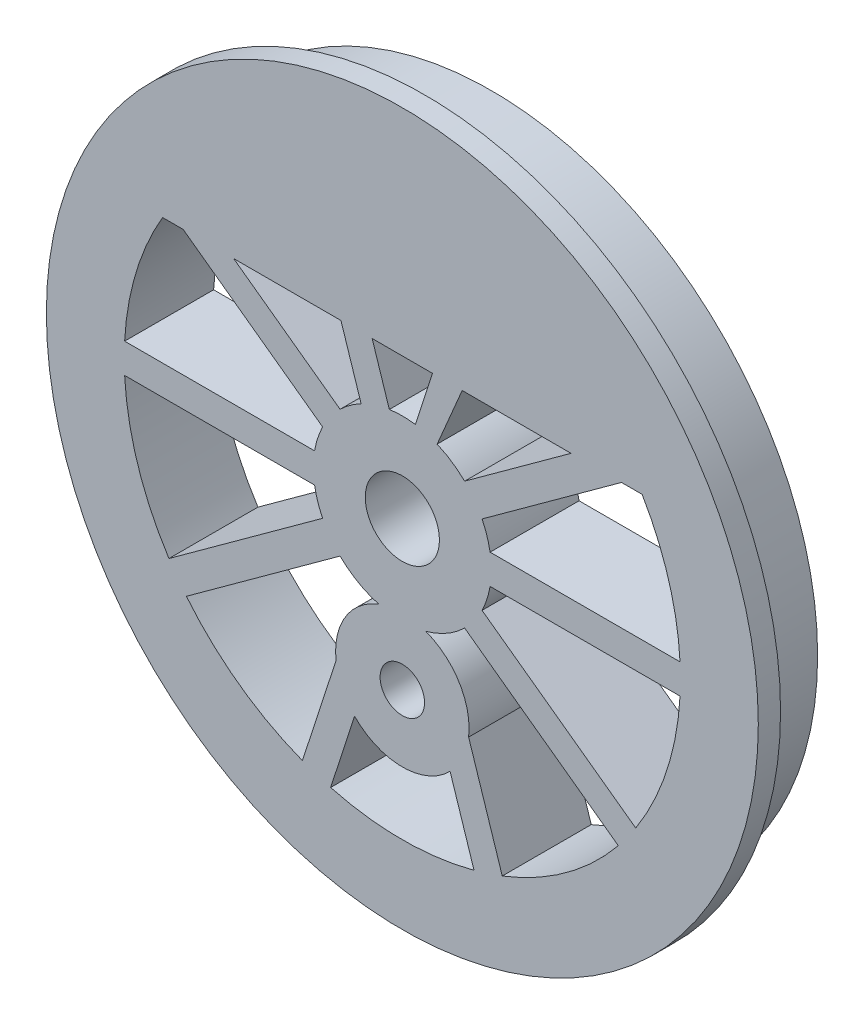
from build123d import *

# Parameters (mm, degrees)
ESQUISSE1_R        = 6
ESQUISSE1_R_2      = 2.5
ESQUISSE1_R_3      = 1.5
BOSS_EXTRU_1_DEPTH = 6
BOSS_EXTRU_2_START = -1.5
ESQUISSE3_R        = 24
ESQUISSE3_R_2      = 22
BOSS_EXTRU_2_DEPTH = 1.5


with BuildPart() as part:
    # Esquisse1 → Boss.-Extru.1 (new body)
    # profile 1 of 61: a face of its own
    with BuildSketch(Plane.XY):
        Circle(ESQUISSE1_R)
        Circle(ESQUISSE1_R_2, mode=Mode.SUBTRACT)
    # profile 2 of 61: a face of its own
    with BuildSketch(Plane.XY):
        with BuildLine():
            Line((-14.776929861, 9.5), (-5.373994337, 2.668367454))
            ThreePointArc((-5.373994337, 2.668367454), (-4.854101966, 3.526711514), (-4.198423832, 4.286401442))
            Line((-4.198423832, 4.286401442), (-11.374326628, 9.5))
            Line((-11.374326628, 9.5), (-14.776929861, 9.5))
        make_face()
    # profile 3 of 61: a face of its own
    with BuildSketch(Plane.XY):
        with BuildLine():
            Line((-14.559694243, 11.814305039), (-11.374326628, 9.5))
            Line((-11.374326628, 9.5), (-4.138199338, 9.5))
            Line((-4.138199338, 9.5), (-4.469792035, 10.520537382))
            Line((-4.469792035, 10.520537382), (-6.736878839, 17.497913119))
            ThreePointArc((-6.736878839, 17.497913119), (-11.02097348, 15.169068645), (-14.559694243, 11.814305039))
        make_face()
    # profile 4 of 61: a face of its own
    with BuildSketch(Plane.XY):
        with BuildLine():
            Line((-4.138199338, 9.5), (-2.03527489, 9.5))
            Line((-2.03527489, 9.5), (-3.219339867, 13.144177288))
            Line((-3.219339867, 13.144177288), (-4.834765807, 18.115947107))
            ThreePointArc((-4.834765807, 18.115947107), (-5.794068645, 17.832309681), (-6.736878839, 17.497913119))
            Line((-6.736878839, 17.497913119), (-4.469792035, 10.520537382))
            Line((-4.469792035, 10.520537382), (-4.138199338, 9.5))
        make_face()
    # profile 5 of 61: a face of its own
    with BuildSketch(Plane.XY):
        with BuildLine():
            Line((-2.03527489, 9.5), (2.03527489, 9.5))
            Line((2.03527489, 9.5), (3.219339867, 13.144177288))
            Line((3.219339867, 13.144177288), (4.834765807, 18.115947107))
            ThreePointArc((4.834765807, 18.115947107), (0, 18.75), (-4.834765807, 18.115947107))
            Line((-4.834765807, 18.115947107), (-3.219339867, 13.144177288))
            Line((-3.219339867, 13.144177288), (-2.03527489, 9.5))
        make_face()
    # profile 6 of 61: a face of its own
    with BuildSketch(Plane.XY):
        with BuildLine():
            Line((2.03527489, 9.5), (4.03620298, 9.5))
            Line((4.03620298, 9.5), (4.469792035, 10.520537382))
            Line((4.469792035, 10.520537382), (6.736878839, 17.497913119))
            ThreePointArc((6.736878839, 17.497913119), (5.794068645, 17.832309681), (4.834765807, 18.115947107))
            Line((4.834765807, 18.115947107), (3.219339867, 13.144177288))
            Line((3.219339867, 13.144177288), (2.03527489, 9.5))
        make_face()
    # profile 7 of 61: a face of its own
    with BuildSketch(Plane.XY):
        with BuildLine():
            Line((4.03620298, 9.5), (11.374326628, 9.5))
            Line((11.374326628, 9.5), (14.559694243, 11.814305039))
            ThreePointArc((14.559694243, 11.814305039), (11.02097348, 15.169068645), (6.736878839, 17.497913119))
            Line((6.736878839, 17.497913119), (4.469792035, 10.520537382))
            Line((4.469792035, 10.520537382), (4.03620298, 9.5))
        make_face()
    # profile 8 of 61: a face of its own
    with BuildSketch(Plane.XY):
        with BuildLine():
            Line((11.374326628, 9.5), (14.776929861, 9.5))
            Line((14.776929861, 9.5), (15.735264747, 10.196271051))
            ThreePointArc((15.735264747, 10.196271051), (15.169068645, 11.02097348), (14.559694243, 11.814305039))
            Line((14.559694243, 11.814305039), (11.374326628, 9.5))
        make_face()
    # profile 9 of 61: a face of its own
    with BuildSketch(Plane.XY):
        with BuildLine():
            ThreePointArc((4.198423832, 4.286401442), (4.854101966, 3.526711514), (5.373994337, 2.668367454))
            Line((5.373994337, 2.668367454), (14.776929861, 9.5))
            Line((14.776929861, 9.5), (11.374326628, 9.5))
            Line((11.374326628, 9.5), (4.198423832, 4.286401442))
        make_face()
    # profile 10 of 61: a face of its own
    with BuildSketch(Plane.XY):
        with BuildLine():
            ThreePointArc((0.877112677, 5.935543223), (1.624852602, 5.775798994), (2.346205228, 5.522256878))
            Line((2.346205228, 5.522256878), (4.03620298, 9.5))
            Line((4.03620298, 9.5), (2.03527489, 9.5))
            Line((2.03527489, 9.5), (0.877112677, 5.935543223))
        make_face()
    # profile 11 of 61: a face of its own
    with BuildSketch(Plane.XY):
        with BuildLine():
            ThreePointArc((-2.779225709, 5.317509234), (-1.854101966, 5.706339098), (-0.877112677, 5.935543223))
            Line((-0.877112677, 5.935543223), (-2.03527489, 9.5))
            Line((-2.03527489, 9.5), (-4.138199338, 9.5))
            Line((-4.138199338, 9.5), (-2.779225709, 5.317509234))
        make_face()
    # profile 12 of 61: a face of its own
    with BuildSketch(Plane.XY):
        with BuildLine():
            Line((-14.559694243, -11.814305039), (-4.198423832, -4.286401442))
            ThreePointArc((-4.198423832, -4.286401442), (-4.854101966, -3.526711514), (-5.373994337, -2.668367454))
            Line((-5.373994337, -2.668367454), (-15.735264747, -10.196271051))
            ThreePointArc((-15.735264747, -10.196271051), (-15.169068645, -11.02097348), (-14.559694243, -11.814305039))
        make_face()
    # profile 13 of 61: a face of its own
    with BuildSketch(Plane.XY):
        with BuildLine():
            Line((-18.723314343, -1), (-5.916079783, -1))
            ThreePointArc((-5.916079783, -1), (-6, 0), (-5.916079783, 1))
            Line((-5.916079783, 1), (-18.723314343, 1))
            ThreePointArc((-18.723314343, 1), (-18.75, 0), (-18.723314343, -1))
        make_face()
    # profile 14 of 61: a face of its own
    with BuildSketch(Plane.XY):
        with BuildLine():
            ThreePointArc((6, 0), (5.978983137, -0.501757562), (5.916079783, -1))
            Line((5.916079783, -1), (18.723314343, -1))
            ThreePointArc((18.723314343, -1), (18.743327399, -0.500177999), (18.75, 0))
            ThreePointArc((18.75, 0), (18.743327399, 0.500177999), (18.723314343, 1))
            Line((18.723314343, 1), (5.916079783, 1))
            ThreePointArc((5.916079783, 1), (5.978983137, 0.501757562), (6, 0))
        make_face()
    # profile 15 of 61: a face of its own
    with BuildSketch(Plane.XY):
        with BuildLine():
            ThreePointArc((18.723314343, -1), (17.832309681, -5.794068645), (15.735264747, -10.196271051))
            Line((15.735264747, -10.196271051), (16.342858961, -10.637714087))
            ThreePointArc((16.342858961, -10.637714087), (18.545602068, -6.02583139), (19.474342094, -1))
            Line((19.474342094, -1), (18.723314343, -1))
        make_face()
    # profile 16 of 61: a face of its own
    with BuildSketch(Plane.XY):
        with BuildLine():
            ThreePointArc((18.75, 0), (18.743327399, -0.500177999), (18.723314343, -1))
            Line((18.723314343, -1), (19.474342094, -1))
            ThreePointArc((19.474342094, -1), (19.493584468, -0.500164555), (19.5, 0))
            ThreePointArc((19.5, 0), (19.493584468, 0.500164555), (19.474342094, 1))
            Line((19.474342094, 1), (18.723314343, 1))
            ThreePointArc((18.723314343, 1), (18.743327399, 0.500177999), (18.75, 0))
        make_face()
    # profile 17 of 61: a face of its own
    with BuildSketch(Plane.XY):
        with BuildLine():
            ThreePointArc((16.16516316, 9.5), (17.954497087, 5.403566819), (18.723314343, 1))
            Line((18.723314343, 1), (19.474342094, 1))
            ThreePointArc((19.474342094, 1), (18.545602068, 6.02583139), (16.342858961, 10.637714087))
            Line((16.342858961, 10.637714087), (15.735264747, 10.196271051))
            ThreePointArc((15.735264747, 10.196271051), (15.954012771, 9.850481028), (16.16516316, 9.5))
        make_face()
    # profile 18 of 61: a face of its own
    with BuildSketch(Plane.XY):
        with BuildLine():
            Line((15.735264747, 10.196271051), (16.342858961, 10.637714087))
            ThreePointArc((16.342858961, 10.637714087), (15.77583139, 11.46181242), (15.167288456, 12.255748075))
            Line((15.167288456, 12.255748075), (14.559694243, 11.814305039))
            ThreePointArc((14.559694243, 11.814305039), (15.169068645, 11.02097348), (15.735264747, 10.196271051))
        make_face()
    # profile 19 of 61: a face of its own
    with BuildSketch(Plane.XY):
        with BuildLine():
            Line((14.559694243, 11.814305039), (15.167288456, 12.255748075))
            ThreePointArc((15.167288456, 12.255748075), (11.46181242, 15.77583139), (6.968959178, 18.212182955))
            Line((6.968959178, 18.212182955), (6.736878839, 17.497913119))
            ThreePointArc((6.736878839, 17.497913119), (11.02097348, 15.169068645), (14.559694243, 11.814305039))
        make_face()
    # profile 20 of 61: a face of its own
    with BuildSketch(Plane.XY):
        with BuildLine():
            Line((6.736878839, 17.497913119), (6.968959178, 18.212182955))
            ThreePointArc((6.968959178, 18.212182955), (6.02583139, 18.545602068), (5.066846145, 18.830216944))
            Line((5.066846145, 18.830216944), (4.834765807, 18.115947107))
            ThreePointArc((4.834765807, 18.115947107), (5.794068645, 17.832309681), (6.736878839, 17.497913119))
        make_face()
    # profile 21 of 61: a face of its own
    with BuildSketch(Plane.XY):
        with BuildLine():
            Line((4.834765807, 18.115947107), (5.066846145, 18.830216944))
            ThreePointArc((5.066846145, 18.830216944), (0, 19.5), (-5.066846145, 18.830216944))
            Line((-5.066846145, 18.830216944), (-4.834765807, 18.115947107))
            ThreePointArc((-4.834765807, 18.115947107), (0, 18.75), (4.834765807, 18.115947107))
        make_face()
    # profile 22 of 61: a face of its own
    with BuildSketch(Plane.XY):
        with BuildLine():
            Line((-4.834765807, 18.115947107), (-5.066846145, 18.830216944))
            ThreePointArc((-5.066846145, 18.830216944), (-6.02583139, 18.545602068), (-6.968959178, 18.212182955))
            Line((-6.968959178, 18.212182955), (-6.736878839, 17.497913119))
            ThreePointArc((-6.736878839, 17.497913119), (-5.794068645, 17.832309681), (-4.834765807, 18.115947107))
        make_face()
    # profile 23 of 61: a face of its own
    with BuildSketch(Plane.XY):
        with BuildLine():
            Line((-6.736878839, 17.497913119), (-6.968959178, 18.212182955))
            ThreePointArc((-6.968959178, 18.212182955), (-11.46181242, 15.77583139), (-15.167288456, 12.255748075))
            Line((-15.167288456, 12.255748075), (-14.559694243, 11.814305039))
            ThreePointArc((-14.559694243, 11.814305039), (-11.02097348, 15.169068645), (-6.736878839, 17.497913119))
        make_face()
    # profile 24 of 61: a face of its own
    with BuildSketch(Plane.XY):
        with BuildLine():
            ThreePointArc((-15.167288456, 12.255748075), (-15.77583139, 11.46181242), (-16.342858961, 10.637714087))
            Line((-16.342858961, 10.637714087), (-15.735264747, 10.196271051))
            ThreePointArc((-15.735264747, 10.196271051), (-15.169068645, 11.02097348), (-14.559694243, 11.814305039))
            Line((-14.559694243, 11.814305039), (-15.167288456, 12.255748075))
        make_face()
    # profile 25 of 61: a face of its own
    with BuildSketch(Plane.XY):
        with BuildLine():
            Line((-19.474342094, 1), (-18.723314343, 1))
            ThreePointArc((-18.723314343, 1), (-17.954497087, 5.403566819), (-16.16516316, 9.5))
            ThreePointArc((-16.16516316, 9.5), (-15.954012771, 9.850481028), (-15.735264747, 10.196271051))
            Line((-15.735264747, 10.196271051), (-16.342858961, 10.637714087))
            ThreePointArc((-16.342858961, 10.637714087), (-18.545602068, 6.02583139), (-19.474342094, 1))
        make_face()
    # profile 26 of 61: a face of its own
    with BuildSketch(Plane.XY):
        with BuildLine():
            Line((-19.474342094, -1), (-18.723314343, -1))
            ThreePointArc((-18.723314343, -1), (-18.75, 0), (-18.723314343, 1))
            Line((-18.723314343, 1), (-19.474342094, 1))
            ThreePointArc((-19.474342094, 1), (-19.5, 0), (-19.474342094, -1))
        make_face()
    # profile 27 of 61: a face of its own
    with BuildSketch(Plane.XY):
        with BuildLine():
            Line((-16.342858961, -10.637714087), (-15.735264747, -10.196271051))
            ThreePointArc((-15.735264747, -10.196271051), (-17.832309681, -5.794068645), (-18.723314343, -1))
            Line((-18.723314343, -1), (-19.474342094, -1))
            ThreePointArc((-19.474342094, -1), (-18.545602068, -6.02583139), (-16.342858961, -10.637714087))
        make_face()
    # profile 28 of 61: a face of its own
    with BuildSketch(Plane.XY):
        with BuildLine():
            Line((-15.167288456, -12.255748075), (-14.559694243, -11.814305039))
            ThreePointArc((-14.559694243, -11.814305039), (-15.169068645, -11.02097348), (-15.735264747, -10.196271051))
            Line((-15.735264747, -10.196271051), (-16.342858961, -10.637714087))
            ThreePointArc((-16.342858961, -10.637714087), (-15.77583139, -11.46181242), (-15.167288456, -12.255748075))
        make_face()
    # profile 29 of 61: a face of its own
    with BuildSketch(Plane.XY):
        with BuildLine():
            Line((5.840290615, -21.210634256), (5.066846145, -18.830216944))
            ThreePointArc((5.066846145, -18.830216944), (0, -19.5), (-5.066846145, -18.830216944))
            Line((-5.066846145, -18.830216944), (-5.840290615, -21.210634256))
            ThreePointArc((-5.840290615, -21.210634256), (0, -22), (5.840290615, -21.210634256))
        make_face()
    # profile 30 of 61: a face of its own
    with BuildSketch(Plane.XY):
        with BuildLine():
            Line((-17.192192367, -13.726926882), (-15.167288456, -12.255748075))
            ThreePointArc((-15.167288456, -12.255748075), (-15.77583139, -11.46181242), (-16.342858961, -10.637714087))
            Line((-16.342858961, -10.637714087), (-18.367762872, -12.108892893))
            ThreePointArc((-18.367762872, -12.108892893), (-17.798373876, -12.93127555), (-17.192192367, -13.726926882))
        make_face()
    # profile 31 of 61: a face of its own
    with BuildSketch(Plane.XY):
        with BuildLine():
            Line((-5.840290615, -21.210634256), (-5.066846145, -18.830216944))
            ThreePointArc((-5.066846145, -18.830216944), (-6.02583139, -18.545602068), (-6.968959178, -18.212182955))
            Line((-6.968959178, -18.212182955), (-7.742403648, -20.592600267))
            ThreePointArc((-7.742403648, -20.592600267), (-6.798373876, -20.923243358), (-5.840290615, -21.210634256))
        make_face()
    # profile 32 of 61: a face of its own
    with BuildSketch(Plane.XY):
        with BuildLine():
            ThreePointArc((-3.219339867, -13.144177288), (-4.06221109, -11.936089115), (-4.469792035, -10.520537382))
            Line((-4.469792035, -10.520537382), (-6.736878839, -17.497913119))
            ThreePointArc((-6.736878839, -17.497913119), (-5.794068645, -17.832309681), (-4.834765807, -18.115947107))
            Line((-4.834765807, -18.115947107), (-3.219339867, -13.144177288))
        make_face()
    # profile 33 of 61: a face of its own
    with BuildSketch(Plane.XY):
        with BuildLine():
            ThreePointArc((4.834765807, -18.115947107), (5.794068645, -17.832309681), (6.736878839, -17.497913119))
            Line((6.736878839, -17.497913119), (4.469792035, -10.520537382))
            ThreePointArc((4.469792035, -10.520537382), (4.06221109, -11.936089115), (3.219339867, -13.144177288))
            Line((3.219339867, -13.144177288), (4.834765807, -18.115947107))
        make_face()
    # profile 34 of 61: a face of its own
    with BuildSketch(Plane.XY):
        with BuildLine():
            Line((7.742403648, -20.592600267), (6.968959178, -18.212182955))
            ThreePointArc((6.968959178, -18.212182955), (6.02583139, -18.545602068), (5.066846145, -18.830216944))
            Line((5.066846145, -18.830216944), (5.840290615, -21.210634256))
            ThreePointArc((5.840290615, -21.210634256), (6.798373876, -20.923243358), (7.742403648, -20.592600267))
        make_face()
    # profile 35 of 61: a face of its own
    with BuildSketch(Plane.XY):
        with BuildLine():
            Line((17.192192367, -13.726926882), (15.167288456, -12.255748075))
            ThreePointArc((15.167288456, -12.255748075), (11.46181242, -15.77583139), (6.968959178, -18.212182955))
            Line((6.968959178, -18.212182955), (7.742403648, -20.592600267))
            ThreePointArc((7.742403648, -20.592600267), (12.93127555, -17.798373876), (17.192192367, -13.726926882))
        make_face()
    # profile 36 of 61: a face of its own
    with BuildSketch(Plane.XY):
        with BuildLine():
            Line((16.342858961, -10.637714087), (15.735264747, -10.196271051))
            ThreePointArc((15.735264747, -10.196271051), (15.169068645, -11.02097348), (14.559694243, -11.814305039))
            Line((14.559694243, -11.814305039), (15.167288456, -12.255748075))
            ThreePointArc((15.167288456, -12.255748075), (15.77583139, -11.46181242), (16.342858961, -10.637714087))
        make_face()
    # profile 37 of 61: a face of its own
    with BuildSketch(Plane.XY):
        with BuildLine():
            Line((15.167288456, -12.255748075), (14.559694243, -11.814305039))
            ThreePointArc((14.559694243, -11.814305039), (11.02097348, -15.169068645), (6.736878839, -17.497913119))
            Line((6.736878839, -17.497913119), (6.968959178, -18.212182955))
            ThreePointArc((6.968959178, -18.212182955), (11.46181242, -15.77583139), (15.167288456, -12.255748075))
        make_face()
    # profile 38 of 61: a face of its own
    with BuildSketch(Plane.XY):
        with BuildLine():
            Line((15.735264747, -10.196271051), (5.373994337, -2.668367454))
            ThreePointArc((5.373994337, -2.668367454), (4.854101966, -3.526711514), (4.198423832, -4.286401442))
            Line((4.198423832, -4.286401442), (14.559694243, -11.814305039))
            ThreePointArc((14.559694243, -11.814305039), (15.169068645, -11.02097348), (15.735264747, -10.196271051))
        make_face()
    # profile 39 of 61: a face of its own
    with BuildSketch(Plane.XY):
        with BuildLine():
            Line((-15.735264747, 10.196271051), (-14.776929861, 9.5))
            Line((-14.776929861, 9.5), (-11.374326628, 9.5))
            Line((-11.374326628, 9.5), (-14.559694243, 11.814305039))
            ThreePointArc((-14.559694243, 11.814305039), (-15.169068645, 11.02097348), (-15.735264747, 10.196271051))
        make_face()
    # profile 40 of 61: a face of its own
    with BuildSketch(Plane.XY):
        with BuildLine():
            ThreePointArc((-15.735264747, 10.196271051), (-15.954012771, 9.850481028), (-16.16516316, 9.5))
            Line((-16.16516316, 9.5), (-14.776929861, 9.5))
            Line((-14.776929861, 9.5), (-15.735264747, 10.196271051))
        make_face()
    # profile 41 of 61: a face of its own
    with BuildSketch(Plane.XY):
        with BuildLine():
            Line((14.776929861, 9.5), (16.16516316, 9.5))
            ThreePointArc((16.16516316, 9.5), (15.954012771, 9.850481028), (15.735264747, 10.196271051))
            Line((15.735264747, 10.196271051), (14.776929861, 9.5))
        make_face()
    # profile 42 of 61: a face of its own
    with BuildSketch(Plane.XY):
        with BuildLine():
            ThreePointArc((15.167288456, 12.255748075), (15.77583139, 11.46181242), (16.342858961, 10.637714087))
            Line((16.342858961, 10.637714087), (18.367762872, 12.108892893))
            ThreePointArc((18.367762872, 12.108892893), (17.798373876, 12.93127555), (17.192192367, 13.726926882))
            Line((17.192192367, 13.726926882), (15.167288456, 12.255748075))
        make_face()
    # profile 43 of 61: a face of its own
    with BuildSketch(Plane.XY):
        with BuildLine():
            ThreePointArc((16.342858961, 10.637714087), (18.545602068, 6.02583139), (19.474342094, 1))
            Line((19.474342094, 1), (21.977260976, 1))
            ThreePointArc((21.977260976, 1), (20.923243358, 6.798373876), (18.367762872, 12.108892893))
            Line((18.367762872, 12.108892893), (16.342858961, 10.637714087))
        make_face()
    # profile 44 of 61: a face of its own
    with BuildSketch(Plane.XY):
        with BuildLine():
            ThreePointArc((19.5, 0), (19.493584468, -0.500164555), (19.474342094, -1))
            Line((19.474342094, -1), (21.977260976, -1))
            ThreePointArc((21.977260976, -1), (21.994314509, -0.500129249), (22, 0))
            ThreePointArc((22, 0), (21.994314509, 0.500129249), (21.977260976, 1))
            Line((21.977260976, 1), (19.474342094, 1))
            ThreePointArc((19.474342094, 1), (19.493584468, 0.500164555), (19.5, 0))
        make_face()
    # profile 45 of 61: a face of its own
    with BuildSketch(Plane.XY):
        with BuildLine():
            ThreePointArc((19.474342094, -1), (18.545602068, -6.02583139), (16.342858961, -10.637714087))
            Line((16.342858961, -10.637714087), (18.367762872, -12.108892893))
            ThreePointArc((18.367762872, -12.108892893), (20.923243358, -6.798373876), (21.977260976, -1))
            Line((21.977260976, -1), (19.474342094, -1))
        make_face()
    # profile 46 of 61: a face of its own
    with BuildSketch(Plane.XY):
        with BuildLine():
            Line((18.367762872, -12.108892893), (16.342858961, -10.637714087))
            ThreePointArc((16.342858961, -10.637714087), (15.77583139, -11.46181242), (15.167288456, -12.255748075))
            Line((15.167288456, -12.255748075), (17.192192367, -13.726926882))
            ThreePointArc((17.192192367, -13.726926882), (17.798373876, -12.93127555), (18.367762872, -12.108892893))
        make_face()
    # profile 47 of 61: a face of its own
    with BuildSketch(Plane.XY):
        with BuildLine():
            ThreePointArc((6.968959178, 18.212182955), (11.46181242, 15.77583139), (15.167288456, 12.255748075))
            Line((15.167288456, 12.255748075), (17.192192367, 13.726926882))
            ThreePointArc((17.192192367, 13.726926882), (12.93127555, 17.798373876), (7.742403648, 20.592600267))
            Line((7.742403648, 20.592600267), (6.968959178, 18.212182955))
        make_face()
    # profile 48 of 61: a face of its own
    with BuildSketch(Plane.XY):
        with BuildLine():
            ThreePointArc((5.066846145, 18.830216944), (6.02583139, 18.545602068), (6.968959178, 18.212182955))
            Line((6.968959178, 18.212182955), (7.742403648, 20.592600267))
            ThreePointArc((7.742403648, 20.592600267), (6.798373876, 20.923243358), (5.840290615, 21.210634256))
            Line((5.840290615, 21.210634256), (5.066846145, 18.830216944))
        make_face()
    # profile 49 of 61: a face of its own
    with BuildSketch(Plane.XY):
        with BuildLine():
            ThreePointArc((-6.968959178, 18.212182955), (-6.02583139, 18.545602068), (-5.066846145, 18.830216944))
            Line((-5.066846145, 18.830216944), (-5.840290615, 21.210634256))
            ThreePointArc((-5.840290615, 21.210634256), (-6.798373876, 20.923243358), (-7.742403648, 20.592600267))
            Line((-7.742403648, 20.592600267), (-6.968959178, 18.212182955))
        make_face()
    # profile 50 of 61: a face of its own
    with BuildSketch(Plane.XY):
        with BuildLine():
            ThreePointArc((-15.167288456, 12.255748075), (-11.46181242, 15.77583139), (-6.968959178, 18.212182955))
            Line((-6.968959178, 18.212182955), (-7.742403648, 20.592600267))
            ThreePointArc((-7.742403648, 20.592600267), (-12.93127555, 17.798373876), (-17.192192367, 13.726926882))
            Line((-17.192192367, 13.726926882), (-15.167288456, 12.255748075))
        make_face()
    # profile 51 of 61: a face of its own
    with BuildSketch(Plane.XY):
        with BuildLine():
            ThreePointArc((-5.066846145, 18.830216944), (0, 19.5), (5.066846145, 18.830216944))
            Line((5.066846145, 18.830216944), (5.840290615, 21.210634256))
            ThreePointArc((5.840290615, 21.210634256), (0, 22), (-5.840290615, 21.210634256))
            Line((-5.840290615, 21.210634256), (-5.066846145, 18.830216944))
        make_face()
    # profile 52 of 61: a face of its own
    with BuildSketch(Plane.XY):
        with BuildLine():
            Line((-18.367762872, 12.108892893), (-16.342858961, 10.637714087))
            ThreePointArc((-16.342858961, 10.637714087), (-15.77583139, 11.46181242), (-15.167288456, 12.255748075))
            Line((-15.167288456, 12.255748075), (-17.192192367, 13.726926882))
            ThreePointArc((-17.192192367, 13.726926882), (-17.798373876, 12.93127555), (-18.367762872, 12.108892893))
        make_face()
    # profile 53 of 61: a face of its own
    with BuildSketch(Plane.XY):
        with BuildLine():
            Line((-21.977260976, 1), (-19.474342094, 1))
            ThreePointArc((-19.474342094, 1), (-18.545602068, 6.02583139), (-16.342858961, 10.637714087))
            Line((-16.342858961, 10.637714087), (-18.367762872, 12.108892893))
            ThreePointArc((-18.367762872, 12.108892893), (-20.923243358, 6.798373876), (-21.977260976, 1))
        make_face()
    # profile 54 of 61: a face of its own
    with BuildSketch(Plane.XY):
        with BuildLine():
            Line((-18.367762872, -12.108892893), (-16.342858961, -10.637714087))
            ThreePointArc((-16.342858961, -10.637714087), (-18.545602068, -6.02583139), (-19.474342094, -1))
            Line((-19.474342094, -1), (-21.977260976, -1))
            ThreePointArc((-21.977260976, -1), (-20.923243358, -6.798373876), (-18.367762872, -12.108892893))
        make_face()
    # profile 55 of 61: a face of its own
    with BuildSketch(Plane.XY):
        with BuildLine():
            Line((-21.977260976, -1), (-19.474342094, -1))
            ThreePointArc((-19.474342094, -1), (-19.5, 0), (-19.474342094, 1))
            Line((-19.474342094, 1), (-21.977260976, 1))
            ThreePointArc((-21.977260976, 1), (-22, 0), (-21.977260976, -1))
        make_face()
    # profile 56 of 61: a face of its own
    with BuildSketch(Plane.XY):
        with BuildLine():
            ThreePointArc((-6.968959178, -18.212182955), (-11.46181242, -15.77583139), (-15.167288456, -12.255748075))
            Line((-15.167288456, -12.255748075), (-17.192192367, -13.726926882))
            ThreePointArc((-17.192192367, -13.726926882), (-12.93127555, -17.798373876), (-7.742403648, -20.592600267))
            Line((-7.742403648, -20.592600267), (-6.968959178, -18.212182955))
        make_face()
    # profile 57 of 61: a face of its own
    with BuildSketch(Plane.XY):
        with BuildLine():
            ThreePointArc((-6.736878839, -17.497913119), (-11.02097348, -15.169068645), (-14.559694243, -11.814305039))
            Line((-14.559694243, -11.814305039), (-15.167288456, -12.255748075))
            ThreePointArc((-15.167288456, -12.255748075), (-11.46181242, -15.77583139), (-6.968959178, -18.212182955))
            Line((-6.968959178, -18.212182955), (-6.736878839, -17.497913119))
        make_face()
    # profile 58 of 61: a face of its own
    with BuildSketch(Plane.XY):
        with BuildLine():
            Line((-5.066846145, -18.830216944), (-4.834765807, -18.115947107))
            ThreePointArc((-4.834765807, -18.115947107), (-5.794068645, -17.832309681), (-6.736878839, -17.497913119))
            Line((-6.736878839, -17.497913119), (-6.968959178, -18.212182955))
            ThreePointArc((-6.968959178, -18.212182955), (-6.02583139, -18.545602068), (-5.066846145, -18.830216944))
        make_face()
    # profile 59 of 61: a face of its own
    with BuildSketch(Plane.XY):
        with BuildLine():
            Line((5.066846145, -18.830216944), (4.834765807, -18.115947107))
            ThreePointArc((4.834765807, -18.115947107), (0, -18.75), (-4.834765807, -18.115947107))
            Line((-4.834765807, -18.115947107), (-5.066846145, -18.830216944))
            ThreePointArc((-5.066846145, -18.830216944), (0, -19.5), (5.066846145, -18.830216944))
        make_face()
    # profile 60 of 61: a face of its own
    with BuildSketch(Plane.XY):
        with BuildLine():
            Line((6.968959178, -18.212182955), (6.736878839, -17.497913119))
            ThreePointArc((6.736878839, -17.497913119), (5.794068645, -17.832309681), (4.834765807, -18.115947107))
            Line((4.834765807, -18.115947107), (5.066846145, -18.830216944))
            ThreePointArc((5.066846145, -18.830216944), (6.02583139, -18.545602068), (6.968959178, -18.212182955))
        make_face()
    # profile 61 of 61: a face of its own
    with BuildSketch(Plane.XY):
        with BuildLine():
            ThreePointArc((4.469792035, -10.520537382), (3.841677281, -7.656601684), (1.582669817, -5.7875))
            ThreePointArc((1.582669817, -5.7875), (0, -6), (-1.582669817, -5.7875))
            ThreePointArc((-1.582669817, -5.7875), (-3.841677281, -7.656601684), (-4.469792035, -10.520537382))
            ThreePointArc((-4.469792035, -10.520537382), (-4.06221109, -11.936089115), (-3.219339867, -13.144177288))
            ThreePointArc((-3.219339867, -13.144177288), (0, -14.5), (3.219339867, -13.144177288))
            ThreePointArc((3.219339867, -13.144177288), (4.06221109, -11.936089115), (4.469792035, -10.520537382))
        make_face()
        with Locations((0, -10)):
            Circle(ESQUISSE1_R_3, mode=Mode.SUBTRACT)
    extrude(amount=BOSS_EXTRU_1_DEPTH)

    # Esquisse3 → Boss.-Extru.2 (add)
    with BuildSketch(Plane.XY.offset(6).offset(BOSS_EXTRU_2_START)):
        Circle(ESQUISSE3_R)
        Circle(ESQUISSE3_R_2, mode=Mode.SUBTRACT)
    extrude(amount=BOSS_EXTRU_2_DEPTH)


solid = part.part
